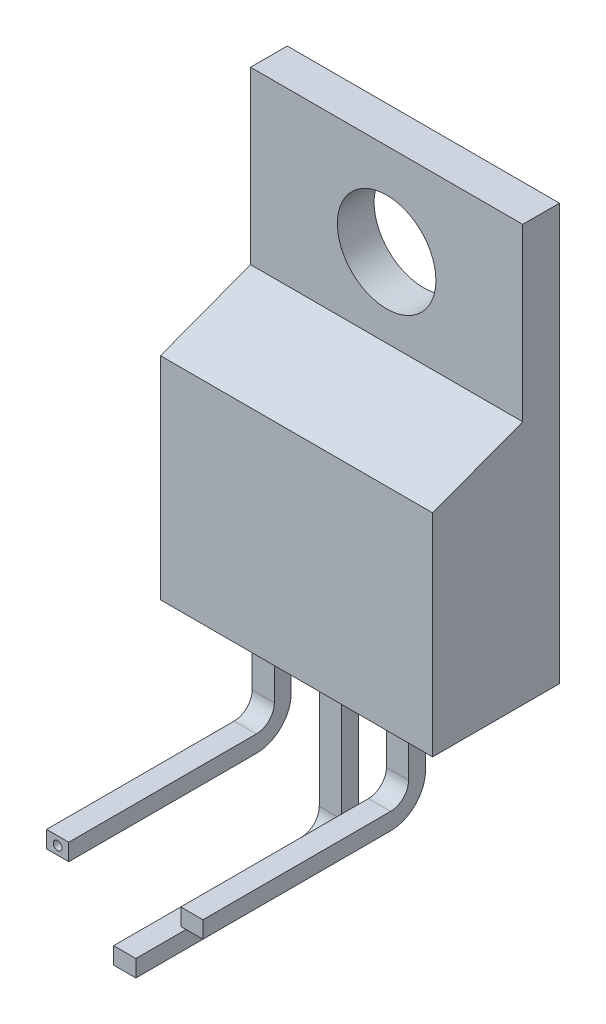
from build123d import *

# Parameters (mm, degrees)
SKETCH_5_W                      = 10.3
SKETCH_5_H                      = 4.8
EXTRUDE_1_DEPTH                 = 15.75
CUT_EXTRUDE_1_REACH             = 23.278
CUT_EXTRUDE_1_DIRECTION_2_REACH = 23.278
SKETCH_11_R                     = 1.865
CUT_EXTRUDE_2_DEPTH             = 4.8
SKETCH_3_W                      = 0.84
SKETCH_3_H                      = 0.64
SKETCH_4_W                      = 0.84
SKETCH_4_H                      = 0.64
SKETCH_3_3_W                    = 0.84
SKETCH_3_3_H                    = 0.64
EXTRUDE_2_DEPTH                 = 2.5
SKETCH_4_3_W                    = 0.84
SKETCH_4_3_H                    = 0.64
EXTRUDE_3_DEPTH                 = 2.5
SKETCH_12_W                     = 0.84
SKETCH_12_H                     = 0.64
EXTRUDE_4_DEPTH                 = 4
SKETCH_13_R                     = 0.16516852
CUT_EXTRUDE_3_DEPTH             = 1


with BuildPart() as part:
    # Эскиз5 → Вытянуть1 (new body)
    with BuildSketch(Plane(origin=(0, 3.5, 0), x_dir=(-1, 0, 0), z_dir=(0, 1, 0))):
        with Locations((-2.54, -2.4)):
            Rectangle(SKETCH_5_W, SKETCH_5_H)
    extrude(amount=EXTRUDE_1_DEPTH)

    # Вырез-Вытянуть1: up to this face of the body (flat: up to its plane)
    cut_extrude_1_end = Plane(part.part.faces().sort_by_distance((-2.61, 11.375, -2.4))[0])
    # Эскиз10 → Вырез-Вытянуть1 (cut, up to the picked face)
    with BuildSketch(Plane(origin=(0, 0, 0), x_dir=(0, 0, -1), z_dir=(1, 0, 0)), mode=Mode.PRIVATE) as cut_extrude_1_sk1:
        Polygon((0, 19.25), (3.41, 19.25), (3.41, 12.78), (0, 11.5), align=None)
    cut_extrude_1_tool1 = split(extrude(cut_extrude_1_sk1.sketch, amount=-CUT_EXTRUDE_1_REACH, mode=Mode.PRIVATE), bisect_by=cut_extrude_1_end, keep=Keep.BOTH, mode=Mode.PRIVATE)
    add(cut_extrude_1_tool1.solids().sort_by(Axis((0, 15.685398, -1.653842), (-1, 0, 0)))[0], mode=Mode.SUBTRACT)

    # Вырез-Вытянуть1 direction 2: up to this face of the body (flat: up to its plane)
    cut_extrude_1_direction_2_end = Plane(part.part.faces().sort_by_distance((7.69, 11.375, -2.4))[0])
    # Эскиз10 → Вырез-Вытянуть1 direction 2 (cut, up to the picked face)
    with BuildSketch(Plane(origin=(0, 0, 0), x_dir=(0, 0, -1), z_dir=(1, 0, 0)), mode=Mode.PRIVATE) as cut_extrude_1_direction_2_sk1:
        Polygon((0, 19.25), (3.41, 19.25), (3.41, 12.78), (0, 11.5), align=None)
    cut_extrude_1_direction_2_tool1 = split(extrude(cut_extrude_1_direction_2_sk1.sketch, amount=CUT_EXTRUDE_1_DIRECTION_2_REACH, mode=Mode.PRIVATE), bisect_by=cut_extrude_1_direction_2_end, keep=Keep.BOTH, mode=Mode.PRIVATE)
    add(cut_extrude_1_direction_2_tool1.solids().sort_by(Axis((0, 15.685398, -1.653842), (1, 0, 0)))[0], mode=Mode.SUBTRACT)

    # Эскиз11 → Вырез-Вытянуть2 (cut)
    with BuildSketch(Plane.XY):
        with Locations((2.54, 15.77)):
            Circle(SKETCH_11_R)
    extrude(amount=-CUT_EXTRUDE_2_DEPTH, mode=Mode.SUBTRACT)

    # По траектории1: sweep along a path in Эскиз8
    with BuildLine(Plane(origin=(0, 0, 0), x_dir=(0, 0, -1), z_dir=(1, 0, 0))) as sweep_1_path:
        Line((0, 0), (0.6, 0))
        ThreePointArc((0.6, 0), (1.307106781, 0.292893219), (1.6, 1))
        Line((1.6, 1), (1.6, 3.5))
    # Эскиз3 → По траектории1 (sweep)
    with BuildSketch(Plane.XY):
        Rectangle(SKETCH_3_W, SKETCH_3_H)
        with Locations((5.08, 0)):
            Rectangle(SKETCH_3_W, SKETCH_3_H)
    sweep(path=sweep_1_path.line)

    # По траектории2: sweep along a path in Эскиз9
    with BuildLine(Plane(origin=(0, 0, 0), x_dir=(0, 0, -1), z_dir=(1, 0, 0))) as sweep_2_path:
        Line((0, -2.54), (0.6, -2.54))
        ThreePointArc((0.6, -2.54), (1.307106781, -2.247106781), (1.6, -1.54))
        Line((1.6, -1.54), (1.6, 4.77))
    # Эскиз4 → По траектории2 (sweep)
    with BuildSketch(Plane.XY):
        with Locations((2.54, -2.54)):
            Rectangle(SKETCH_4_W, SKETCH_4_H)
    sweep(path=sweep_2_path.line)

    # Эскиз3<3> → Вытянуть2 (add)
    with BuildSketch(Plane.XY):
        Rectangle(SKETCH_3_3_W, SKETCH_3_3_H)
        with Locations((5.08, 0)):
            Rectangle(SKETCH_3_3_W, SKETCH_3_3_H)
    extrude(amount=EXTRUDE_2_DEPTH)

    # Эскиз4<3> → Вытянуть3 (add)
    with BuildSketch(Plane.XY):
        with Locations((2.54, -2.54)):
            Rectangle(SKETCH_4_3_W, SKETCH_4_3_H)
    extrude(amount=EXTRUDE_3_DEPTH)

    # Эскиз12 → Вытянуть4 (add)
    with BuildSketch(Plane.XY.offset(2.5)):
        Rectangle(SKETCH_12_W, SKETCH_12_H)
        with Locations((5.08, 0)):
            Rectangle(SKETCH_12_W, SKETCH_12_H)
        with Locations((2.54, -2.54)):
            Rectangle(SKETCH_12_W, SKETCH_12_H)
    extrude(amount=EXTRUDE_4_DEPTH)

    # Эскиз13 → Вырез-Вытянуть3 (cut)
    with BuildSketch(Plane.XY.offset(6.5)):
        Circle(SKETCH_13_R)
    extrude(amount=-CUT_EXTRUDE_3_DEPTH, mode=Mode.SUBTRACT)


solid = part.part
